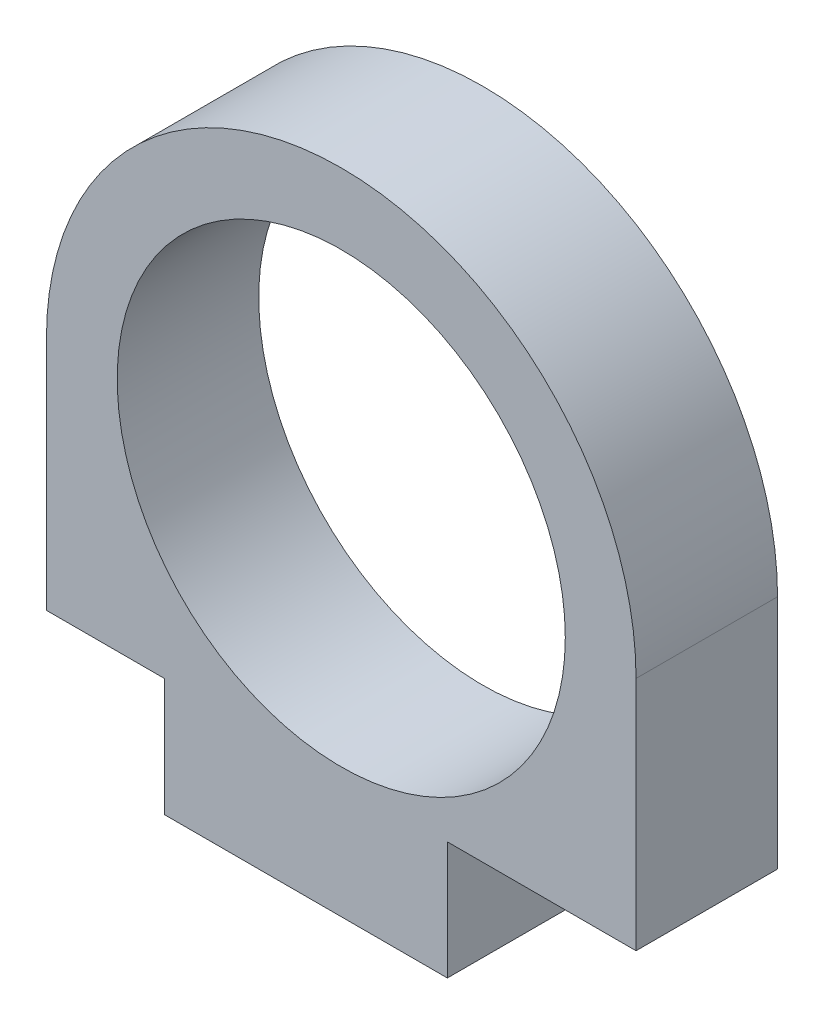
from build123d import *

# Parameters (mm, degrees)
CROQUIS1_R              = 9.5
CROQUIS1_W              = 12
CROQUIS1_H              = 5
SALIENTE_EXTRUIR1_DEPTH = 6


with BuildPart() as part:
    # Croquis1 → Saliente-Extruir1 (new body)
    # profile 1 of 2: a face of its own
    with BuildSketch(Plane.XY):
        with BuildLine():
            Line((-12.5, 0), (-12.5, -10))
            Line((-12.5, -10), (-7.5, -10))
            Line((-7.5, -10), (4.5, -10))
            Line((4.5, -10), (12.5, -10))
            Line((12.5, -10), (12.5, 0))
            ThreePointArc((12.5, 0), (0, 12.5), (-12.5, 0))
        make_face()
        Circle(CROQUIS1_R, mode=Mode.SUBTRACT)
    # profile 2 of 2: a face of its own
    with BuildSketch(Plane.XY):
        with Locations((-1.5, -12.5)):
            Rectangle(CROQUIS1_W, CROQUIS1_H)
    extrude(amount=SALIENTE_EXTRUIR1_DEPTH)


solid = part.part
